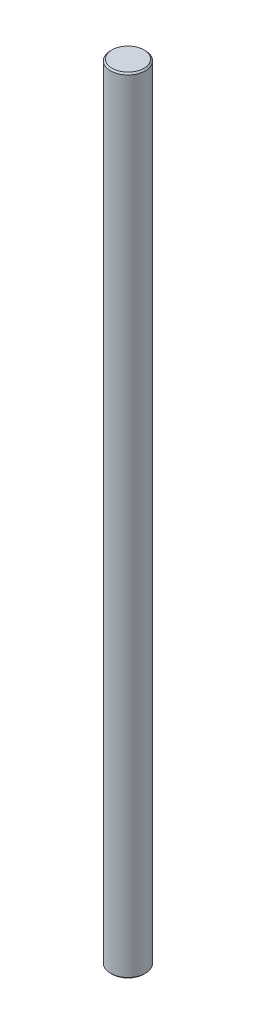
from build123d import *

# Parameters (mm, degrees)
SKETCH1_R           = 6
BOSS_EXTRUDE1_DEPTH = 270
CHAMFER1_SIZE       = 0.5


with BuildPart() as part:
    # Sketch1 → Boss-Extrude1 (new body)
    with BuildSketch(Plane(origin=(0, 0, 0), x_dir=(1, 0, 0), z_dir=(0, 1, 0))):
        with Locations(Location((0, 0, 0), (0, 0, 270))):
            Circle(SKETCH1_R)
    extrude(amount=BOSS_EXTRUDE1_DEPTH)

    # Chamfer1
    chamfer1_edges = [part.edges().sort_by_distance(p)[0] for p in [
        (0, 0, -6),
        (0, 270, -6),
    ]]
    chamfer(chamfer1_edges, length=CHAMFER1_SIZE)


solid = part.part
